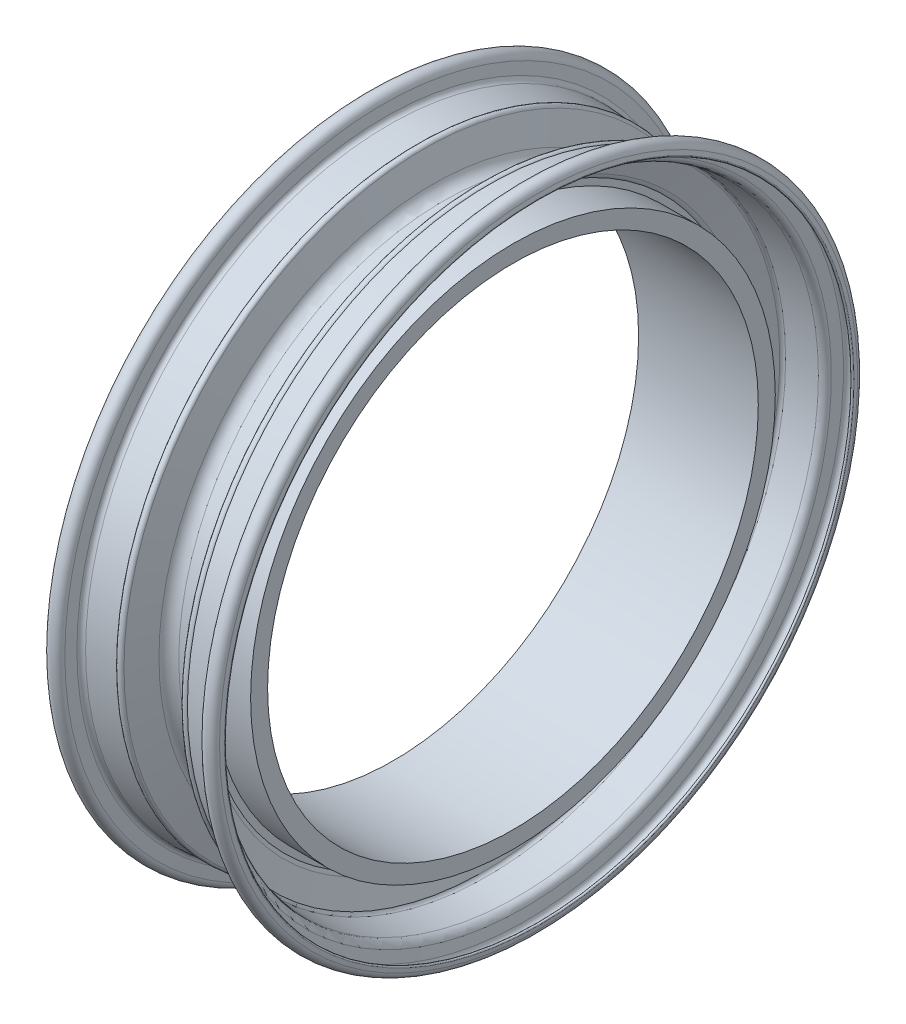
from build123d import *


with BuildPart() as part:
    # Sketch1 → Revolve1 (revolve)
    with BuildSketch(Plane.XY):
        with BuildLine():
            ThreePointArc((-4, 109.6), (-6.837274331, 110.313235926), (-9, 112.28337521))
            Line((-9, 112.28337521), (-9, 109.6))
            Line((-9, 109.6), (-25, 109.6))
            Line((-25, 109.6), (-25, 102.5))
            Line((-25, 102.5), (25, 102.5))
            Line((25, 102.5), (25, 109.6))
            Line((25, 109.6), (9, 109.6))
            Line((9, 109.6), (9, 112.28337521))
            ThreePointArc((9, 112.28337521), (6.837274331, 110.313235926), (4, 109.6))
            Line((4, 109.6), (-4, 109.6))
        make_face()
    revolve(axis=Axis((-265.819064473, 0, 0), (1, 0, 0)))

    # Sketch1<4> → Revolve2 (revolve)
    with BuildSketch(Plane.XY):
        with BuildLine():
            ThreePointArc((-29.155577549, 133.044943929), (-32.322331465, 135.997989729), (-35.687365389, 133.273038986))
            Line((-35.687365389, 133.273038986), (-36, 131.5))
            ThreePointArc((-36, 131.5), (-35.594420212, 130.920772035), (-35.015192247, 131.326351822))
            Line((-35.015192247, 131.326351822), (-34.702557636, 133.099390809))
            ThreePointArc((-34.702557636, 133.099390809), (-32.357230962, 134.998598902), (-30.150099445, 132.940415466))
            Line((-30.150099445, 132.940415466), (-29.670869495, 128.380847066))
            ThreePointArc((-29.670869495, 128.380847066), (-28.776473826, 126.54144183), (-26.910995899, 125.702783772))
            Line((-26.910995899, 125.702783772), (-14.179410402, 124.750815386))
            ThreePointArc((-14.179410402, 124.750815386), (-13.32156382, 124.415106961), (-12.800649539, 123.655337776))
            Line((-12.800649539, 123.655337776), (-9.727341635, 113.811828365))
            ThreePointArc((-9.727341635, 113.811828365), (-7.554642752, 110.766314563), (-4, 109.6))
            Line((-4, 109.6), (4, 109.6))
            ThreePointArc((4, 109.6), (7.554642752, 110.766314563), (9.727341635, 113.811828365))
            Line((9.727341635, 113.811828365), (12.800649539, 123.655337776))
            ThreePointArc((12.800649539, 123.655337776), (13.32156382, 124.415106961), (14.179410402, 124.750815386))
            Line((14.179410402, 124.750815386), (26.910995899, 125.702783772))
            ThreePointArc((26.910995899, 125.702783772), (28.776473826, 126.54144183), (29.670869495, 128.380847066))
            Line((29.670869495, 128.380847066), (30.150099445, 132.940415466))
            ThreePointArc((30.150099445, 132.940415466), (32.357230962, 134.998598902), (34.702557636, 133.099390809))
            Line((34.702557636, 133.099390809), (35.015192247, 131.326351822))
            ThreePointArc((35.015192247, 131.326351822), (35.594420212, 130.920772035), (36, 131.5))
            Line((36, 131.5), (35.687365389, 133.273038986))
            ThreePointArc((35.687365389, 133.273038986), (32.322331465, 135.997989729), (29.155577549, 133.044943929))
            Line((29.155577549, 133.044943929), (28.676347599, 128.48537553))
            ThreePointArc((28.676347599, 128.48537553), (28.08008382, 127.259105372), (26.836431869, 126.7))
            Line((26.836431869, 126.7), (14.799869398, 125.8))
            ThreePointArc((14.799869398, 125.8), (13.363938855, 126.265926936), (12.25, 125.247042909))
            Line((12.25, 125.247042909), (8.772784696, 114.109856971))
            ThreePointArc((8.772784696, 114.109856971), (6.962202293, 111.571928802), (4, 110.6))
            Line((4, 110.6), (-4, 110.6))
            ThreePointArc((-4, 110.6), (-6.962202293, 111.571928802), (-8.772784696, 114.109856971))
            Line((-8.772784696, 114.109856971), (-12.25, 125.247042909))
            ThreePointArc((-12.25, 125.247042909), (-13.363938855, 126.265926936), (-14.799869398, 125.8))
            Line((-14.799869398, 125.8), (-26.836431869, 126.7))
            ThreePointArc((-26.836431869, 126.7), (-28.08008382, 127.259105372), (-28.676347599, 128.48537553))
            Line((-28.676347599, 128.48537553), (-29.155577549, 133.044943929))
        make_face()
    revolve(axis=Axis((-265.819064473, 0, 0), (1, 0, 0)))


solid = part.part
